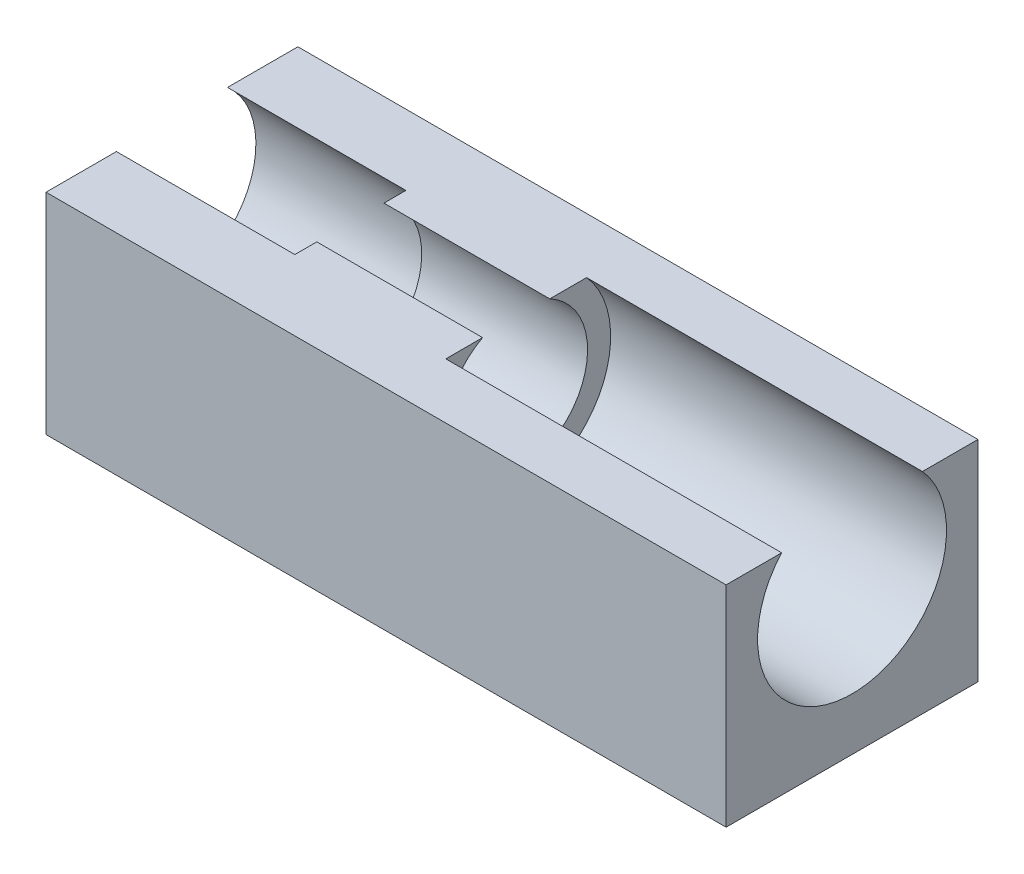
from build123d import *

# Parameters (mm, degrees)
SKETCH_1_W          = 32.4
SKETCH_1_H          = 12
EXTRUDE_1_DEPTH     = 10
SKETCH_4_R          = 4
CUT_EXTRUDE_2_DEPTH = 8.5
SKETCH_7_R          = 3.4
CUT_EXTRUDE_3_DEPTH = 7.9
SKETCH_8_R          = 4.5
CUT_EXTRUDE_4_DEPTH = 16


with BuildPart() as part:
    # 草圖1 → 填料-伸長1 (new body)
    with BuildSketch(Plane(origin=(0, 0, 0), x_dir=(1, 0, 0), z_dir=(0, 1, 0))):
        Rectangle(SKETCH_1_W, SKETCH_1_H)
    extrude(amount=EXTRUDE_1_DEPTH)

    # 草圖4 → 除料-伸長2 (cut)
    with BuildSketch(Plane.ZY.offset(16.2)):
        with Locations((0, 7)):
            Circle(SKETCH_4_R)
    extrude(amount=-CUT_EXTRUDE_2_DEPTH, mode=Mode.SUBTRACT)

    # 草圖7 → 除料-伸長3 (cut)
    with BuildSketch(Plane.ZY.offset(7.7)):
        with Locations((0, 7)):
            Circle(SKETCH_7_R)
    extrude(amount=-CUT_EXTRUDE_3_DEPTH, mode=Mode.SUBTRACT)

    # 草圖8 → 除料-伸長4 (cut)
    with BuildSketch(Plane(origin=(16.2, 0, 0), x_dir=(0, 0, -1), z_dir=(1, 0, 0))):
        with Locations((0, 7)):
            Circle(SKETCH_8_R)
    extrude(amount=-CUT_EXTRUDE_4_DEPTH, mode=Mode.SUBTRACT)


solid = part.part
